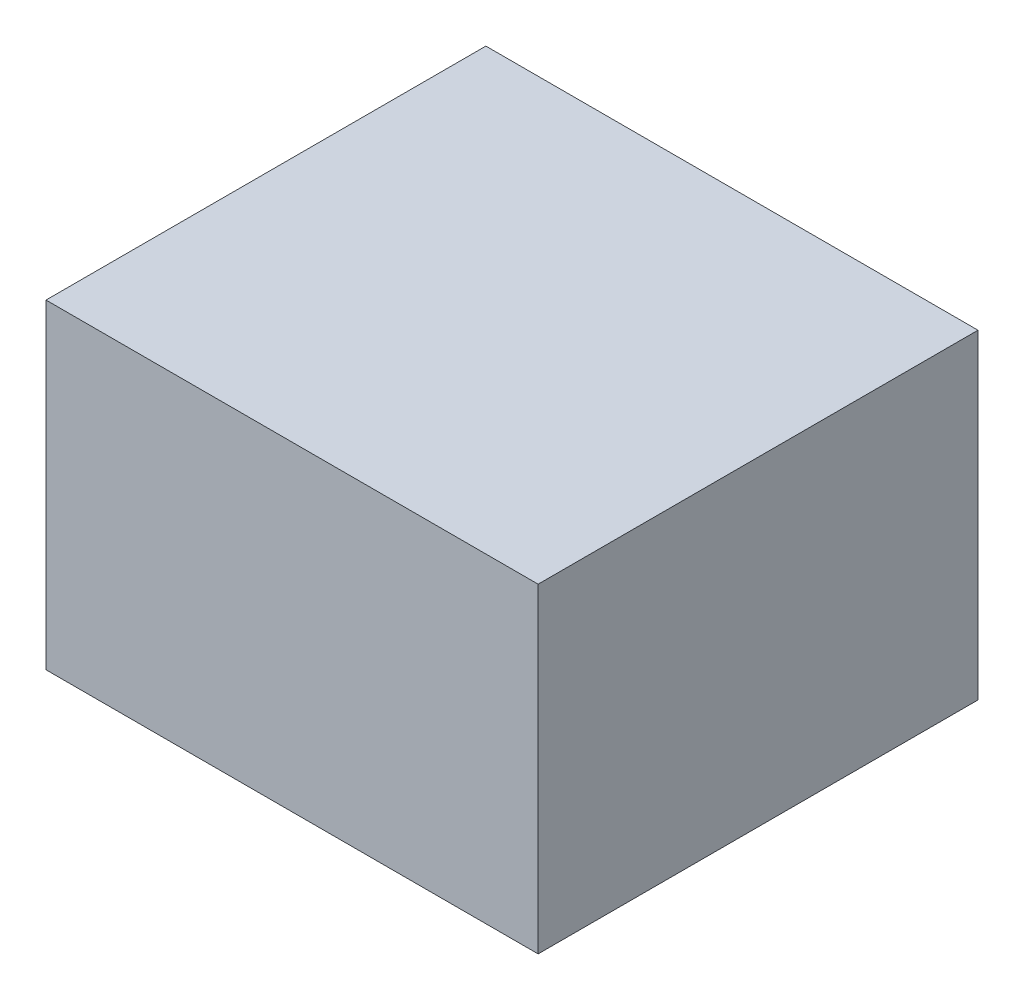
from build123d import *

# Parameters (mm, degrees)
SKETCH1_W           = 292
SKETCH1_H           = 261
BOSS_EXTRUDE1_DEPTH = 95


with BuildPart() as part:
    # Sketch1 → Boss-Extrude1 (new, symmetric)
    with BuildSketch(Plane(origin=(0, 0, 0), x_dir=(1, 0, 0), z_dir=(0, 1, 0))):
        Rectangle(SKETCH1_W, SKETCH1_H)
    extrude(amount=BOSS_EXTRUDE1_DEPTH, both=True)


solid = part.part
